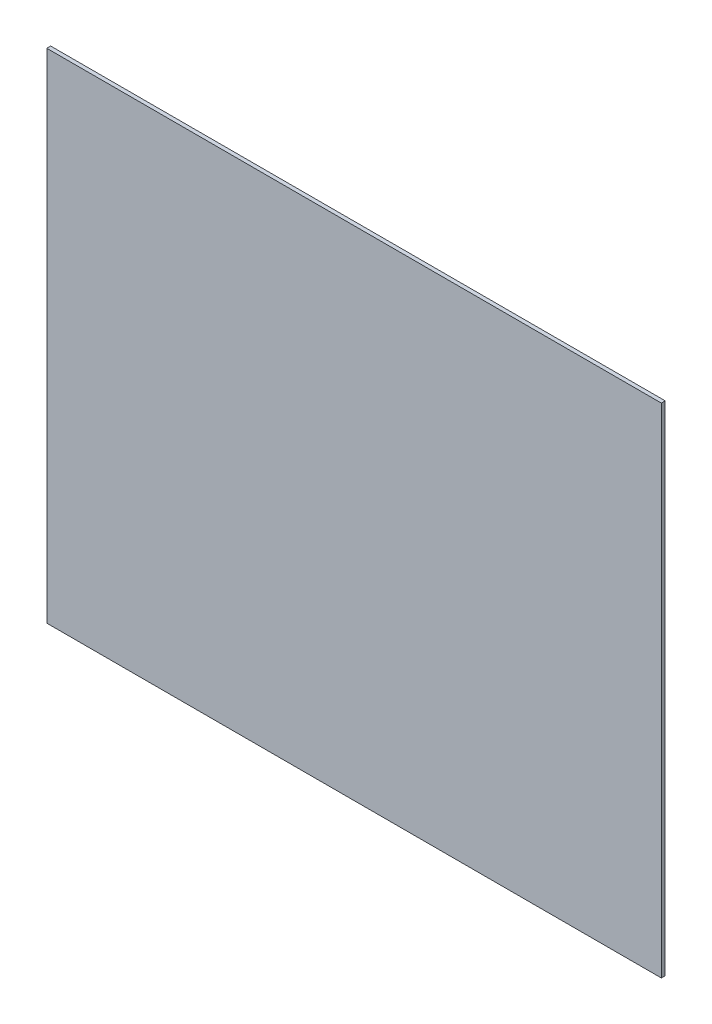
from build123d import *

# Parameters (mm, degrees)
SKETCH1_W           = 250.825
SKETCH1_H           = 203.2
BOSS_EXTRUDE1_DEPTH = 0.79375


with BuildPart() as part:
    # Sketch1 → Boss-Extrude1 (new, symmetric)
    with BuildSketch(Plane.XY):
        with Locations((0, 50.8)):
            Rectangle(SKETCH1_W, SKETCH1_H)
    extrude(amount=BOSS_EXTRUDE1_DEPTH, both=True)


solid = part.part
